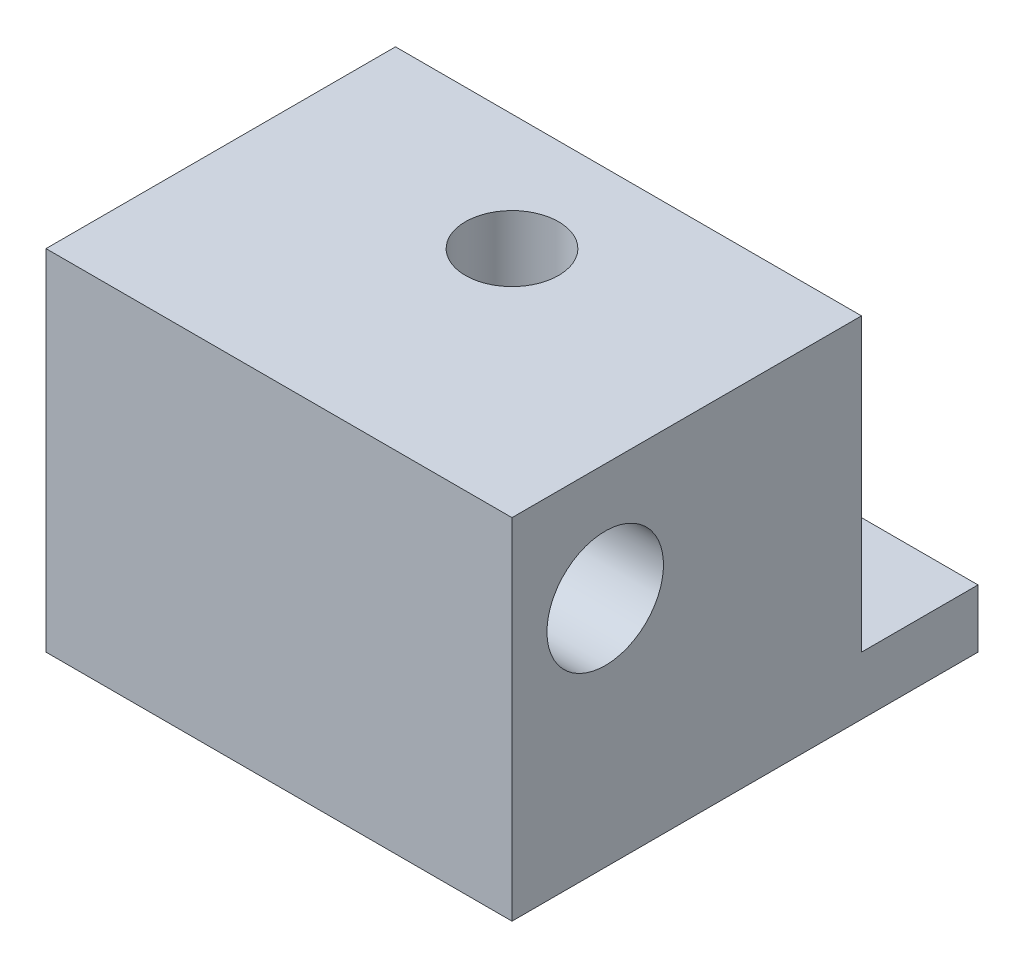
from build123d import *

# Parameters (mm, degrees)
SKETCH1_W               = 40
SKETCH1_H               = 40
BOSS_EXTRUDE1_DEPTH     = 30
SKETCH2_R               = 4
CUT_EXTRUDE1_DEPTH      = 42.231056256
CUT_EXTRUDE2_DEPTH      = 54.851648071
CUT_EXTRUDE2_DEPTH_BACK = 54.851648071
SKETCH3_R               = 5
SKETCH4_W               = 10
SKETCH4_H               = 25
CUT_EXTRUDE3_DEPTH      = 54.851648071


with BuildPart() as part:
    # Sketch1 → Boss-Extrude1 (new body)
    with BuildSketch(Plane(origin=(0, 0, 0), x_dir=(1, 0, 0), z_dir=(0, 1, 0))):
        Rectangle(SKETCH1_W, SKETCH1_H)
    extrude(amount=BOSS_EXTRUDE1_DEPTH)

    # Sketch2 → Cut-Extrude1 (cut, through all)
    with BuildSketch(Plane(origin=(0, 30, 0), x_dir=(1, 0, 0), z_dir=(0, 1, 0))):
        with Locations(Location((0, 0, 0), (0, 0, 270))):
            Circle(SKETCH2_R)
    extrude(amount=-CUT_EXTRUDE1_DEPTH, mode=Mode.SUBTRACT)

    # Sketch3 → Cut-Extrude2 (cut, two sides: drawn at the far end of the back side and taken through both)
    with BuildSketch(Plane.ZY.offset(20).offset(-CUT_EXTRUDE2_DEPTH_BACK)):
        with Locations((12, 20)):
            Circle(SKETCH3_R)
    extrude(amount=CUT_EXTRUDE2_DEPTH + CUT_EXTRUDE2_DEPTH_BACK, mode=Mode.SUBTRACT)

    # Sketch4 → Cut-Extrude3 (cut, through all)
    with BuildSketch(Plane.ZY.offset(20)):
        with Locations((-15, 17.5)):
            Rectangle(SKETCH4_W, SKETCH4_H)
    extrude(amount=-CUT_EXTRUDE3_DEPTH, mode=Mode.SUBTRACT)


solid = part.part
